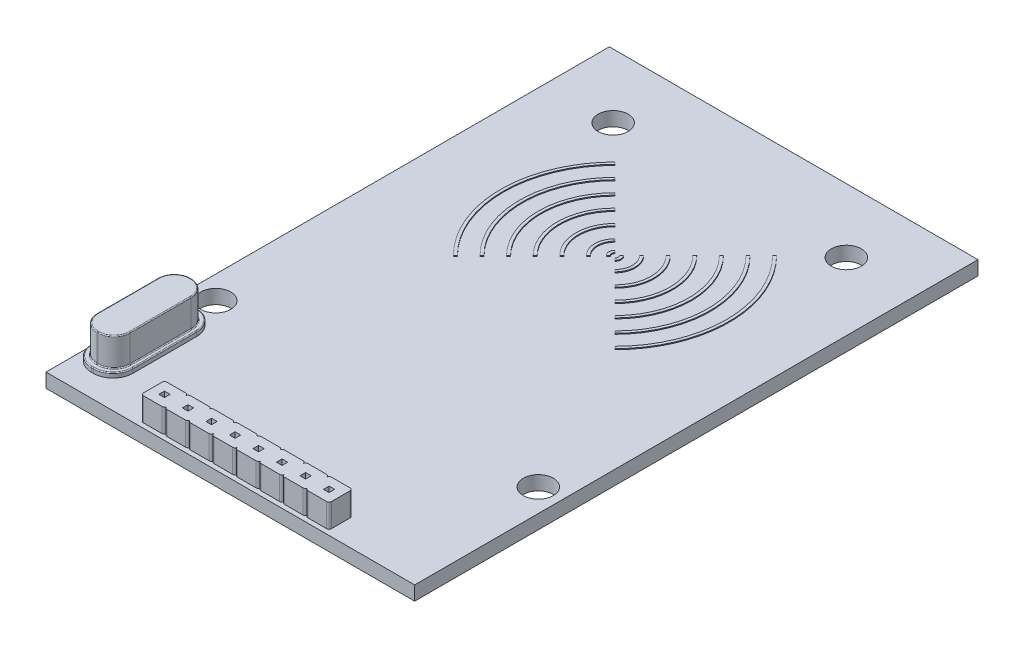
from build123d import *

# Parameters (mm, degrees)
SKETCH1_W           = 39.2
SKETCH1_H           = 59.9
BOSS_EXTRUDE1_DEPTH = 1.5
SKETCH3_R           = 1.6
CUT_EXTRUDE1_DEPTH  = 1.5
BOSS_EXTRUDE3_DEPTH = 2.5
SKETCH5_W           = 0.6
SKETCH5_H           = 0.6
CUT_EXTRUDE2_DEPTH  = 4
BOSS_EXTRUDE4_DEPTH = 0.5
BOSS_EXTRUDE5_DEPTH = 3
FILLET1_R           = 0.1
BOSS_EXTRUDE6_DEPTH = 0.1


with BuildPart() as part:
    # Sketch1 → Boss-Extrude1 (new body)
    with BuildSketch(Plane(origin=(0, 0, 0), x_dir=(1, 0, 0), z_dir=(0, 1, 0))):
        Rectangle(SKETCH1_W, SKETCH1_H)
    extrude(amount=BOSS_EXTRUDE1_DEPTH)

    # Sketch3 → Cut-Extrude1 (cut)
    with BuildSketch(Plane(origin=(0, 1.5, 0), x_dir=(1, 0, 0), z_dir=(0, 1, 0))):
        with Locations(Location((12.4, 23.15, 0), (0, 0, 270))):
            Circle(SKETCH3_R)
        with Locations(Location((-12.4, 23.15, 0), (0, 0, 270))):
            Circle(SKETCH3_R)
        with Locations(Location((17.15, -14.35, 0), (0, 0, 270))):
            Circle(SKETCH3_R)
        with Locations(Location((-17.15, -14.35, 0), (0, 0, 270))):
            Circle(SKETCH3_R)
    extrude(amount=-CUT_EXTRUDE1_DEPTH, mode=Mode.SUBTRACT)

    # Sketch4 → Boss-Extrude3 (add)
    with BuildSketch(Plane(origin=(0, 1.5, 0), x_dir=(1, 0, 0), z_dir=(0, 1, 0))):
        with BuildLine():
            Line((-9.75, -26.95), (-7.75, -26.95))
            ThreePointArc((-7.75, -26.95), (-7.573223305, -27.023223305), (-7.5, -27.2))
            ThreePointArc((-7.5, -27.2), (-7.426776695, -27.023223305), (-7.25, -26.95))
            Line((-7.25, -26.95), (-5.25, -26.95))
            ThreePointArc((-5.25, -26.95), (-5.073223305, -27.023223305), (-5, -27.2))
            ThreePointArc((-5, -27.2), (-4.926776695, -27.023223305), (-4.75, -26.95))
            Line((-4.75, -26.95), (-2.75, -26.95))
            ThreePointArc((-2.75, -26.95), (-2.573223305, -27.023223305), (-2.5, -27.2))
            ThreePointArc((-2.5, -27.2), (-2.426776695, -27.023223305), (-2.25, -26.95))
            Line((-2.25, -26.95), (-0.25, -26.95))
            ThreePointArc((-0.25, -26.95), (-0.073223305, -27.023223305), (0, -27.2))
            ThreePointArc((0, -27.2), (0.073223305, -27.023223305), (0.25, -26.95))
            Line((0.25, -26.95), (2.25, -26.95))
            ThreePointArc((2.25, -26.95), (2.426776695, -27.023223305), (2.5, -27.2))
            ThreePointArc((2.5, -27.2), (2.573223305, -27.023223305), (2.75, -26.95))
            Line((2.75, -26.95), (4.75, -26.95))
            ThreePointArc((4.75, -26.95), (4.926776695, -27.023223305), (5, -27.2))
            ThreePointArc((5, -27.2), (5.073223305, -27.023223305), (5.25, -26.95))
            Line((5.25, -26.95), (7.25, -26.95))
            ThreePointArc((7.25, -26.95), (7.426776695, -27.023223305), (7.5, -27.2))
            ThreePointArc((7.5, -27.2), (7.573223305, -27.023223305), (7.75, -26.95))
            Line((7.75, -26.95), (9.75, -26.95))
            ThreePointArc((9.75, -26.95), (9.926776695, -27.023223305), (10, -27.2))
            Line((10, -27.2), (10, -29.2))
            ThreePointArc((10, -29.2), (9.926776695, -29.376776695), (9.75, -29.45))
            Line((9.75, -29.45), (7.75, -29.45))
            ThreePointArc((7.75, -29.45), (7.573223305, -29.376776695), (7.5, -29.2))
            ThreePointArc((7.5, -29.2), (7.426776695, -29.376776695), (7.25, -29.45))
            Line((7.25, -29.45), (5.25, -29.45))
            ThreePointArc((5.25, -29.45), (5.073223305, -29.376776695), (5, -29.2))
            ThreePointArc((5, -29.2), (4.926776695, -29.376776695), (4.75, -29.45))
            Line((4.75, -29.45), (2.75, -29.45))
            ThreePointArc((2.75, -29.45), (2.573223305, -29.376776695), (2.5, -29.2))
            ThreePointArc((2.5, -29.2), (2.426776695, -29.376776695), (2.25, -29.45))
            Line((2.25, -29.45), (0.25, -29.45))
            ThreePointArc((0.25, -29.45), (0.073223305, -29.376776695), (0, -29.2))
            ThreePointArc((0, -29.2), (-0.073223305, -29.376776695), (-0.25, -29.45))
            Line((-0.25, -29.45), (-2.25, -29.45))
            ThreePointArc((-2.25, -29.45), (-2.426776695, -29.376776695), (-2.5, -29.2))
            ThreePointArc((-2.5, -29.2), (-2.573223305, -29.376776695), (-2.75, -29.45))
            Line((-2.75, -29.45), (-4.75, -29.45))
            ThreePointArc((-4.75, -29.45), (-4.926776695, -29.376776695), (-5, -29.2))
            ThreePointArc((-5, -29.2), (-5.073223305, -29.376776695), (-5.25, -29.45))
            Line((-5.25, -29.45), (-7.25, -29.45))
            ThreePointArc((-7.25, -29.45), (-7.426776695, -29.376776695), (-7.5, -29.2))
            ThreePointArc((-7.5, -29.2), (-7.573223305, -29.376776695), (-7.75, -29.45))
            Line((-7.75, -29.45), (-9.75, -29.45))
            ThreePointArc((-9.75, -29.45), (-9.926776695, -29.376776695), (-10, -29.2))
            Line((-10, -29.2), (-10, -27.2))
            ThreePointArc((-10, -27.2), (-9.926776695, -27.023223305), (-9.75, -26.95))
        make_face()
    extrude(amount=BOSS_EXTRUDE3_DEPTH)

    # Sketch5 → Cut-Extrude2 (cut)
    with BuildSketch(Plane(origin=(0, 4, 0), x_dir=(1, 0, 0), z_dir=(0, 1, 0))):
        with Locations((-8.75, -28.2)):
            Rectangle(SKETCH5_W, SKETCH5_H)
        with Locations((-6.25, -28.2)):
            Rectangle(SKETCH5_W, SKETCH5_H)
        with Locations((-3.75, -28.2)):
            Rectangle(SKETCH5_W, SKETCH5_H)
        with Locations((-1.25, -28.2)):
            Rectangle(SKETCH5_W, SKETCH5_H)
        with Locations((1.25, -28.2)):
            Rectangle(SKETCH5_W, SKETCH5_H)
        with Locations((3.75, -28.2)):
            Rectangle(SKETCH5_W, SKETCH5_H)
        with Locations((6.25, -28.2)):
            Rectangle(SKETCH5_W, SKETCH5_H)
        with Locations((8.75, -28.2)):
            Rectangle(SKETCH5_W, SKETCH5_H)
    extrude(amount=-CUT_EXTRUDE2_DEPTH, mode=Mode.SUBTRACT)

    # Sketch8 → Boss-Extrude4 (add)
    with BuildSketch(Plane(origin=(0, 1.5, 0), x_dir=(1, 0, 0), z_dir=(0, 1, 0))):
        with BuildLine():
            Line((-17.160025397, -16.55), (-16.960025397, -16.55))
            ThreePointArc((-16.960025397, -16.55), (-15.475101156, -17.16507576), (-14.860025397, -18.65))
            Line((-14.860025397, -18.65), (-14.860025397, -25.45))
            ThreePointArc((-14.860025397, -25.45), (-15.475101156, -26.93492424), (-16.960025397, -27.55))
            Line((-16.960025397, -27.55), (-17.160025397, -27.55))
            ThreePointArc((-17.160025397, -27.55), (-18.644949637, -26.93492424), (-19.260025397, -25.45))
            Line((-19.260025397, -25.45), (-19.260025397, -18.65))
            ThreePointArc((-19.260025397, -18.65), (-18.644949637, -17.16507576), (-17.160025397, -16.55))
        make_face()
    extrude(amount=BOSS_EXTRUDE4_DEPTH)

    # Sketch10 → Boss-Extrude5 (add)
    with BuildSketch(Plane(origin=(0, 2, 0), x_dir=(1, 0, 0), z_dir=(0, 1, 0))):
        with BuildLine():
            Line((-17.110025397, -17.1), (-17.010025397, -17.1))
            ThreePointArc((-17.010025397, -17.1), (-15.807943869, -17.597918472), (-15.310025397, -18.8))
            Line((-15.310025397, -18.8), (-15.310025397, -25.3))
            ThreePointArc((-15.310025397, -25.3), (-15.807943869, -26.502081528), (-17.010025397, -27))
            Line((-17.010025397, -27), (-17.110025397, -27))
            ThreePointArc((-17.110025397, -27), (-18.312106925, -26.502081528), (-18.810025397, -25.3))
            Line((-18.810025397, -25.3), (-18.810025397, -18.8))
            ThreePointArc((-18.810025397, -18.8), (-18.312106925, -17.597918472), (-17.110025397, -17.1))
        make_face()
    extrude(amount=BOSS_EXTRUDE5_DEPTH)

    # Fillet1
    fillet1_edges = [part.edges().sort_by_distance(p)[0] for p in [
        (-18.644949637, 2, 26.93492424),
        (-17.060025397, 2, 27.55),
        (-15.475101156, 2, 26.93492424),
        (-14.860025397, 2, 22.05),
        (-15.475101156, 2, 17.16507576),
        (-17.060025397, 2, 16.55),
        (-18.644949637, 2, 17.16507576),
        (-19.260025397, 2, 22.05),
        (-18.312106925, 2, 26.502081528),
        (-17.060025397, 2, 27),
        (-15.807943869, 2, 26.502081528),
        (-15.310025397, 2, 22.05),
        (-15.807943869, 2, 17.597918472),
        (-17.060025397, 2, 17.1),
        (-18.312106925, 2, 17.597918472),
        (-18.810025397, 2, 22.05),
        (-18.312106925, 5, 26.502081528),
        (-17.060025397, 5, 27),
        (-15.807943869, 5, 26.502081528),
        (-15.310025397, 5, 22.05),
        (-15.807943869, 5, 17.597918472),
        (-17.060025397, 5, 17.1),
        (-18.312106925, 5, 17.597918472),
        (-18.810025397, 5, 22.05),
    ]]
    fillet(fillet1_edges, radius=FILLET1_R)

    # Sketch11 → Boss-Extrude6 (add)
    with BuildSketch(Plane(origin=(0, 1.5, 0), x_dir=(1, 0, 0), z_dir=(0, 1, 0))):
        with BuildLine():
            Line((-0.247487373, 11.197487373), (-0.459619408, 11.409619408))
            ThreePointArc((-0.459619408, 11.409619408), (-0.65, 10.95), (-0.459619408, 10.490380592))
            Line((-0.459619408, 10.490380592), (-0.247487373, 10.702512627))
            ThreePointArc((-0.247487373, 10.702512627), (-0.35, 10.95), (-0.247487373, 11.197487373))
        make_face()
        with BuildLine():
            Line((0.247487373, 11.197487373), (0.459619408, 11.409619408))
            ThreePointArc((0.459619408, 11.409619408), (0.65, 10.95), (0.459619408, 10.490380592))
            Line((0.459619408, 10.490380592), (0.247487373, 10.702512627))
            ThreePointArc((0.247487373, 10.702512627), (0.35, 10.95), (0.247487373, 11.197487373))
        make_face()
        with BuildLine():
            Line((-8.485281374, 19.435281374), (-8.591347391, 19.541347391))
            ThreePointArc((-8.591347391, 19.541347391), (-12.15, 10.95), (-8.591347391, 2.358652609))
            Line((-8.591347391, 2.358652609), (-8.485281374, 2.464718626))
            Line((-8.485281374, 2.464718626), (-8.379215357, 2.570784643))
            ThreePointArc((-8.379215357, 2.570784643), (-11.85, 10.95), (-8.379215357, 19.329215357))
            Line((-8.379215357, 19.329215357), (-8.485281374, 19.435281374))
        make_face()
        with BuildLine():
            Line((8.485281374, 2.464718626), (8.591347391, 2.358652609))
            ThreePointArc((8.591347391, 2.358652609), (12.15, 10.95), (8.591347391, 19.541347391))
            Line((8.591347391, 19.541347391), (8.485281374, 19.435281374))
            Line((8.485281374, 19.435281374), (8.379215357, 19.329215357))
            ThreePointArc((8.379215357, 19.329215357), (11.85, 10.95), (8.379215357, 2.570784643))
            Line((8.379215357, 2.570784643), (8.485281374, 2.464718626))
        make_face()
        with BuildLine():
            Line((-6.965001795, 17.915001795), (-7.177133829, 18.127133829))
            ThreePointArc((-7.177133829, 18.127133829), (-10.15, 10.95), (-7.177133829, 3.772866171))
            Line((-7.177133829, 3.772866171), (-6.965001795, 3.984998205))
            ThreePointArc((-6.965001795, 3.984998205), (-9.85, 10.95), (-6.965001795, 17.915001795))
        make_face()
        with BuildLine():
            Line((-5.550788232, 16.500788232), (-5.762920267, 16.712920267))
            ThreePointArc((-5.762920267, 16.712920267), (-8.15, 10.95), (-5.762920267, 5.187079733))
            Line((-5.762920267, 5.187079733), (-5.550788232, 5.399211768))
            ThreePointArc((-5.550788232, 5.399211768), (-7.85, 10.95), (-5.550788232, 16.500788232))
        make_face()
        with BuildLine():
            Line((-4.13657467, 15.08657467), (-4.348706704, 15.298706704))
            ThreePointArc((-4.348706704, 15.298706704), (-6.15, 10.95), (-4.348706704, 6.601293296))
            Line((-4.348706704, 6.601293296), (-4.13657467, 6.81342533))
            ThreePointArc((-4.13657467, 6.81342533), (-5.85, 10.95), (-4.13657467, 15.08657467))
        make_face()
        with BuildLine():
            Line((-2.722361108, 13.672361108), (-2.934493142, 13.884493142))
            ThreePointArc((-2.934493142, 13.884493142), (-4.15, 10.95), (-2.934493142, 8.015506858))
            Line((-2.934493142, 8.015506858), (-2.722361108, 8.227638892))
            ThreePointArc((-2.722361108, 8.227638892), (-3.85, 10.95), (-2.722361108, 13.672361108))
        make_face()
        with BuildLine():
            Line((-1.308147545, 12.258147545), (-1.52027958, 12.47027958))
            ThreePointArc((-1.52027958, 12.47027958), (-2.15, 10.95), (-1.52027958, 9.42972042))
            Line((-1.52027958, 9.42972042), (-1.308147545, 9.641852455))
            ThreePointArc((-1.308147545, 9.641852455), (-1.85, 10.95), (-1.308147545, 12.258147545))
        make_face()
        with BuildLine():
            Line((1.308147545, 9.641852455), (1.52027958, 9.42972042))
            ThreePointArc((1.52027958, 9.42972042), (2.15, 10.95), (1.52027958, 12.47027958))
            Line((1.52027958, 12.47027958), (1.308147545, 12.258147545))
            ThreePointArc((1.308147545, 12.258147545), (1.85, 10.95), (1.308147545, 9.641852455))
        make_face()
        with BuildLine():
            Line((2.722361108, 8.227638892), (2.934493142, 8.015506858))
            ThreePointArc((2.934493142, 8.015506858), (4.15, 10.95), (2.934493142, 13.884493142))
            Line((2.934493142, 13.884493142), (2.722361108, 13.672361108))
            ThreePointArc((2.722361108, 13.672361108), (3.85, 10.95), (2.722361108, 8.227638892))
        make_face()
        with BuildLine():
            Line((4.13657467, 6.81342533), (4.348706704, 6.601293296))
            ThreePointArc((4.348706704, 6.601293296), (6.15, 10.95), (4.348706704, 15.298706704))
            Line((4.348706704, 15.298706704), (4.13657467, 15.08657467))
            ThreePointArc((4.13657467, 15.08657467), (5.85, 10.95), (4.13657467, 6.81342533))
        make_face()
        with BuildLine():
            Line((5.550788232, 5.399211768), (5.762920267, 5.187079733))
            ThreePointArc((5.762920267, 5.187079733), (8.15, 10.95), (5.762920267, 16.712920267))
            Line((5.762920267, 16.712920267), (5.550788232, 16.500788232))
            ThreePointArc((5.550788232, 16.500788232), (7.85, 10.95), (5.550788232, 5.399211768))
        make_face()
        with BuildLine():
            Line((6.965001795, 3.984998205), (7.177133829, 3.772866171))
            ThreePointArc((7.177133829, 3.772866171), (10.15, 10.95), (7.177133829, 18.127133829))
            Line((7.177133829, 18.127133829), (6.965001795, 17.915001795))
            ThreePointArc((6.965001795, 17.915001795), (9.85, 10.95), (6.965001795, 3.984998205))
        make_face()
    extrude(amount=BOSS_EXTRUDE6_DEPTH)


solid = part.part
